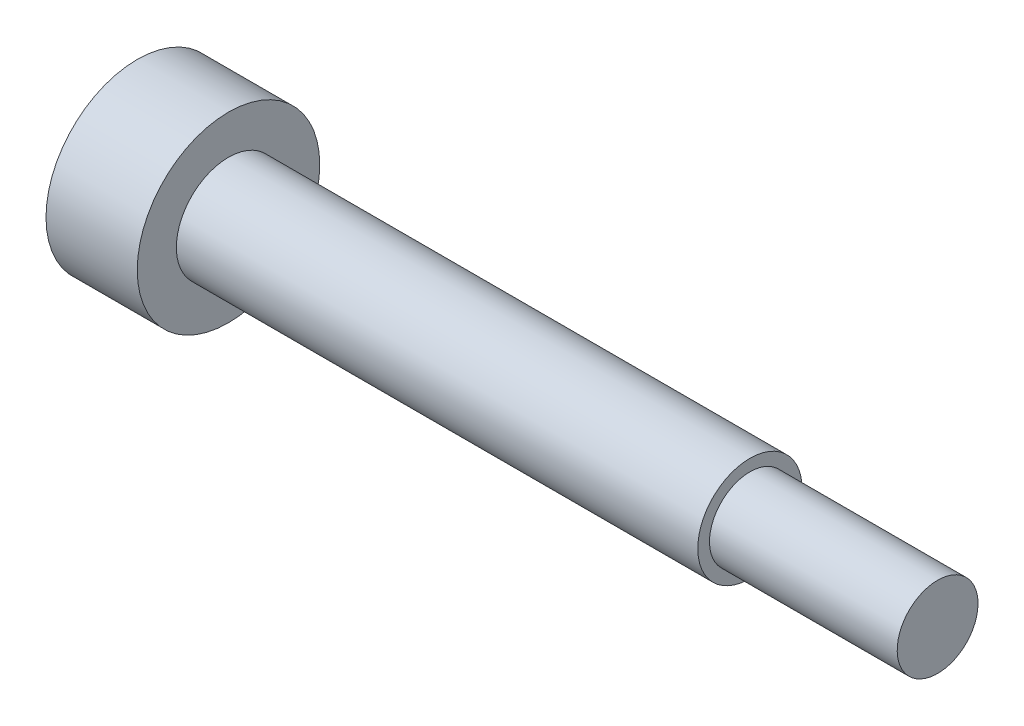
from build123d import *


with BuildPart() as part:
    # 草图1 → 旋转1 (revolve)
    with BuildSketch(Plane.XY):
        Polygon((0, 0), (0, 3.5), (3.5, 3.5), (3.5, 2), (23.5, 2), (23.5, 1.55), (30.7, 1.55), (30.7, 0), align=None)
    revolve(axis=Axis((30.7, 0, 0), (-1, 0, 0)))


solid = part.part
